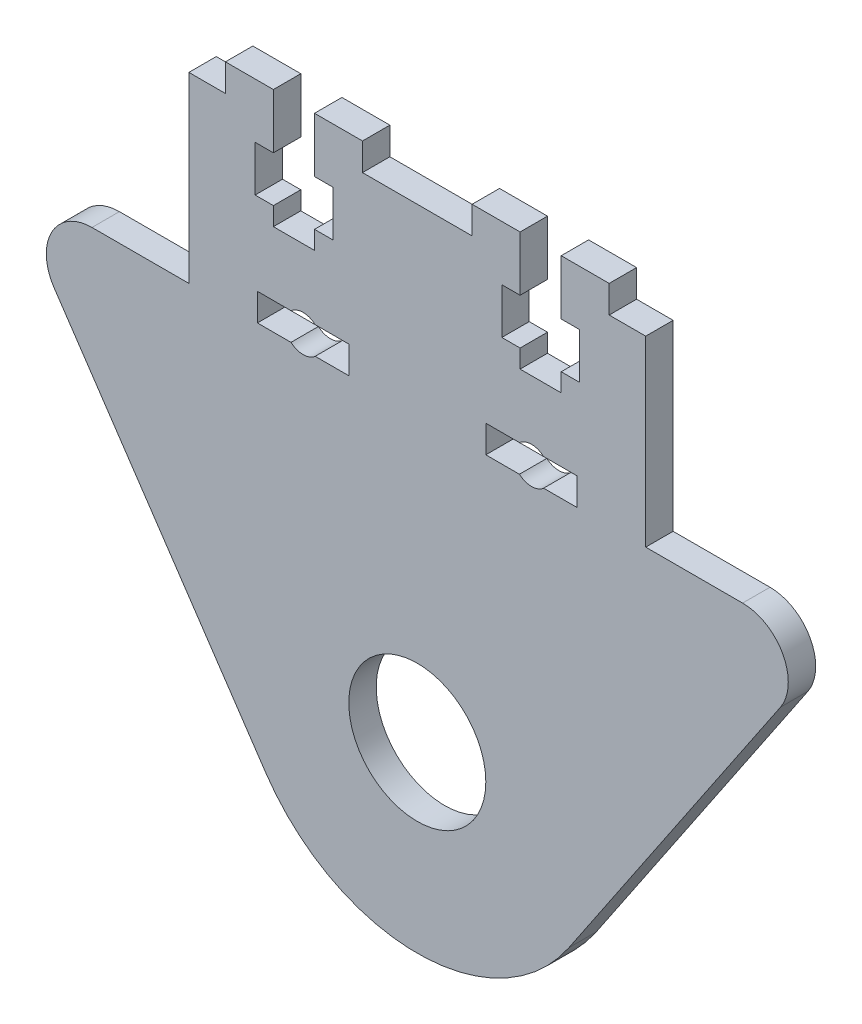
from build123d import *

# Parameters (mm, degrees)
SKETCH_1_W          = 25
SKETCH_1_H          = 20
EXTRUDE_1_DEPTH     = 3
FILLET_1_R          = 5
CUT_EXTRUDE_1_DEPTH = 3
SKETCH_3_W          = 15
SKETCH_3_H          = 3
EXTRUDE_2_DEPTH     = 3
CUT_EXTRUDE_2_DEPTH = 3


with BuildPart() as part:
    # 草图1 → 凸台-拉伸1 (new body)
    with BuildSketch(Plane.XY):
        with BuildLine():
            ThreePointArc((0, 20), (-17.656339801, 9.39434217), (-16.586969757, -11.174633519))
            ThreePointArc((-16.586969757, -11.174633519), (-9.39434217, -17.656339801), (0, -20))
            Line((0, -20), (0, -7.5))
            ThreePointArc((0, -7.5), (-7.5, 0), (0, 7.5))
            Line((0, 7.5), (0, 20))
        make_face()
        with BuildLine():
            ThreePointArc((20, 0), (14.142135624, 14.142135624), (0, 20))
            Line((0, 20), (0, 7.5))
            ThreePointArc((0, 7.5), (5.303300859, 5.303300859), (7.5, 0))
            ThreePointArc((7.5, 0), (5.303300859, -5.303300859), (0, -7.5))
            Line((0, -7.5), (0, -20))
            ThreePointArc((0, -20), (9.39434217, -17.656339801), (16.586969757, -11.174633519))
            ThreePointArc((16.586969757, -11.174633519), (19.127720658, -5.842114551), (20, 0))
        make_face()
        with BuildLine():
            Line((25, 31), (0, 31))
            Line((0, 31), (0, 20))
            ThreePointArc((0, 20), (14.142135624, 14.142135624), (20, 0))
            ThreePointArc((20, 0), (19.127720658, -5.842114551), (16.586969757, -11.174633519))
            Line((16.586969757, -11.174633519), (45, 31))
            Line((45, 31), (25, 31))
        make_face()
        with BuildLine():
            Line((-25, 31), (-45, 31))
            Line((-45, 31), (-16.586969757, -11.174633519))
            ThreePointArc((-16.586969757, -11.174633519), (-17.656339801, 9.39434217), (0, 20))
            Line((0, 20), (0, 31))
            Line((0, 31), (-25, 31))
        make_face()
        with Locations((-12.5, 41)):
            Rectangle(SKETCH_1_W, SKETCH_1_H)
        with Locations((12.5, 41)):
            Rectangle(SKETCH_1_W, SKETCH_1_H)
    extrude(amount=EXTRUDE_1_DEPTH)

    # 圆角1
    fillet_1_edges = [part.edges().sort_by_distance(p)[0] for p in [
        (45, 31, 1.5),
        (-45, 31, 1.5),
    ]]
    fillet(fillet_1_edges, radius=FILLET_1_R)

    # 草图2 → 切除-拉伸1 (cut)
    with BuildSketch(Plane.XY.offset(3)):
        with BuildLine():
            Line((-17.5, 34), (-13.822875656, 34))
            ThreePointArc((-13.822875656, 34), (-12.5, 34.5), (-11.177124344, 34))
            Line((-11.177124344, 34), (-7.5, 34))
            Line((-7.5, 34), (-7.5, 31))
            Line((-7.5, 31), (-11.177124344, 31))
            ThreePointArc((-11.177124344, 31), (-12.5, 30.5), (-13.822875656, 31))
            Line((-13.822875656, 31), (-17.5, 31))
            Line((-17.5, 31), (-17.5, 34))
        make_face()
        with BuildLine():
            Line((7.5, 34), (11.177124344, 34))
            ThreePointArc((11.177124344, 34), (12.5, 34.5), (13.822875656, 34))
            Line((13.822875656, 34), (17.5, 34))
            Line((17.5, 34), (17.5, 31))
            Line((17.5, 31), (13.822875656, 31))
            ThreePointArc((13.822875656, 31), (12.5, 30.5), (11.177124344, 31))
            Line((11.177124344, 31), (7.5, 31))
            Line((7.5, 31), (7.5, 34))
        make_face()
    extrude(amount=-CUT_EXTRUDE_1_DEPTH, mode=Mode.SUBTRACT)

    # 草图3 → 凸台-拉伸2 (add)
    with BuildSketch(Plane.XY.offset(3)):
        with Locations((-13.5, 52.5)):
            Rectangle(SKETCH_3_W, SKETCH_3_H)
        with Locations((13.5, 52.5)):
            Rectangle(SKETCH_3_W, SKETCH_3_H)
    extrude(amount=-EXTRUDE_2_DEPTH)

    # 草图4 → 切除-拉伸2 (cut)
    with BuildSketch(Plane.XY.offset(3)):
        Polygon((-15.75, 54), (-15.75, 48), (-17.75, 48), (-17.75, 43), (-15.75, 43), (-15.75, 41), (-11.25, 41), (-11.25, 43), (-9.25, 43), (-9.25, 48), (-11.25, 48), (-11.25, 54), align=None)
        Polygon((11.25, 48), (11.25, 54), (15.75, 54), (15.75, 48), (17.75, 48), (17.75, 43), (15.75, 43), (15.75, 41), (11.25, 41), (11.25, 43), (9.25, 43), (9.25, 48), align=None)
    extrude(amount=-CUT_EXTRUDE_2_DEPTH, mode=Mode.SUBTRACT)


solid = part.part
